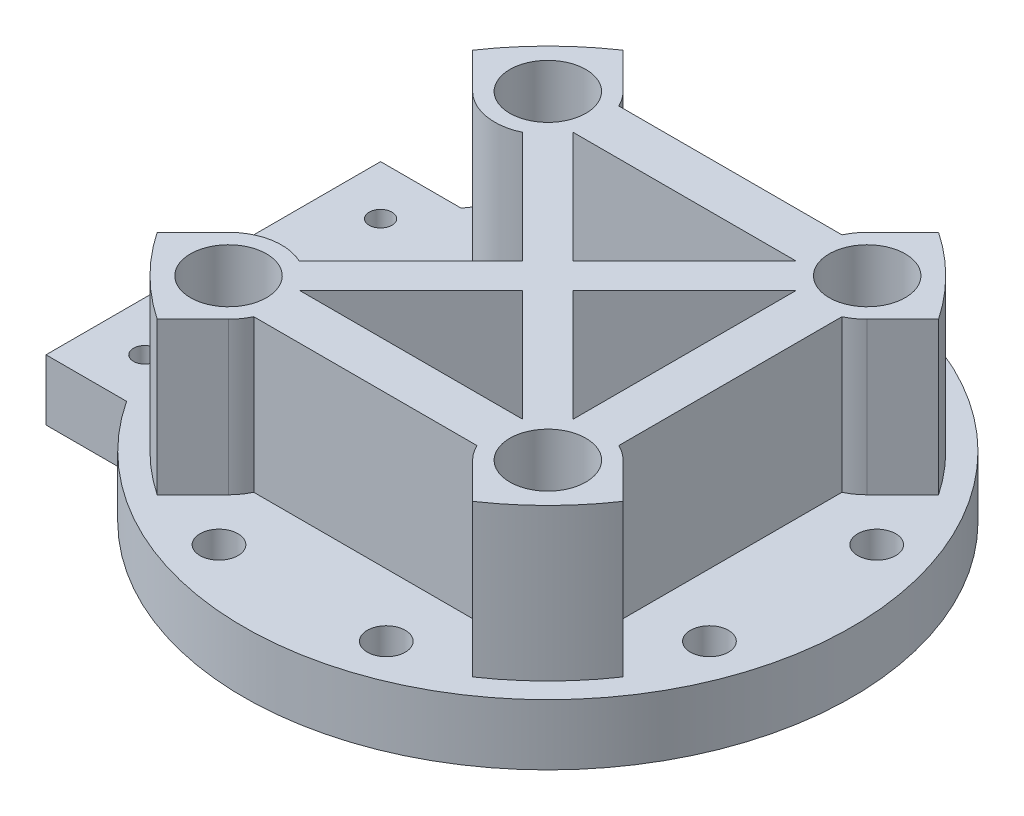
from build123d import *

# Parameters (mm, degrees)
SKETCH1_R           = 40
SKETCH1_R_2         = 9.5
SKETCH1_R_3         = 2.5
BOSS_EXTRUDE2_DEPTH = 8
SKETCH3_R           = 1.5
CUT_EXTRUDE1_DEPTH  = 8
SKETCH4_R           = 7
SKETCH4_R_2         = 5
BOSS_EXTRUDE6_DEPTH = 20


with BuildPart() as part:
    # Sketch1 → Boss-Extrude2 (new body)
    # profile 1 of 2: a face of its own
    with BuildSketch(Plane(origin=(0, 0, 0), x_dir=(1, 0, 0), z_dir=(0, 1, 0))):
        with BuildLine():
            Line((-44, 22), (-44, -22))
            Line((-44, -22), (-33.406586177, -22))
            ThreePointArc((-33.406586177, -22), (-40, 0), (-33.406586177, 22))
            Line((-33.406586177, 22), (-44, 22))
        make_face()
    # profile 2 of 2: a face of its own
    with BuildSketch(Plane(origin=(0, 0, 0), x_dir=(1, 0, 0), z_dir=(0, 1, 0))):
        Circle(SKETCH1_R)
        with Locations(Location((-22, 0, 0), (0, 0, 270))):
            Circle(SKETCH1_R_2, mode=Mode.SUBTRACT)
        with Locations(Location((11, 32.25, 0), (0, 0, 270))):
            Circle(SKETCH1_R_3, mode=Mode.SUBTRACT)
        with Locations(Location((-11, 32.25, 0), (0, 0, 270))):
            Circle(SKETCH1_R_3, mode=Mode.SUBTRACT)
        with Locations(Location((11, -32.25, 0), (0, 0, 270))):
            Circle(SKETCH1_R_3, mode=Mode.SUBTRACT)
        with Locations(Location((-11, -32.25, 0), (0, 0, 270))):
            Circle(SKETCH1_R_3, mode=Mode.SUBTRACT)
        with Locations(Location((32.25, -11, 0), (0, 0, 270))):
            Circle(SKETCH1_R_3, mode=Mode.SUBTRACT)
        with Locations(Location((32.25, 11, 0), (0, 0, 270))):
            Circle(SKETCH1_R_3, mode=Mode.SUBTRACT)
    extrude(amount=BOSS_EXTRUDE2_DEPTH)

    # Sketch3 → Cut-Extrude1 (cut)
    with BuildSketch(Plane(origin=(0, 8, 0), x_dir=(1, 0, 0), z_dir=(0, 1, 0))):
        with Locations(Location((-37.5, 15.5, 0), (0, 0, 270))):
            Circle(SKETCH3_R)
        with Locations(Location((-6.5, 15.5, 0), (0, 0, 270))):
            Circle(SKETCH3_R)
        with Locations(Location((-6.5, -15.5, 0), (0, 0, 270))):
            Circle(SKETCH3_R)
        with Locations(Location((-37.5, -15.5, 0), (0, 0, 270))):
            Circle(SKETCH3_R)
    extrude(amount=-CUT_EXTRUDE1_DEPTH, mode=Mode.SUBTRACT)

    # Sketch4 → Boss-Extrude6 (add)
    # profile 1 of 16: a face of its own
    with BuildSketch(Plane(origin=(0, 8, 0), x_dir=(1, 0, 0), z_dir=(0, 1, 0))):
        with Locations((-21, -21)):
            Circle(SKETCH4_R)
        with Locations(Location((-21, -21, 0), (0, 0, 270))):
            Circle(SKETCH4_R_2, mode=Mode.SUBTRACT)
    # profile 2 of 16: a face of its own
    with BuildSketch(Plane(origin=(0, 8, 0), x_dir=(1, 0, 0), z_dir=(0, 1, 0))):
        with BuildLine():
            ThreePointArc((-16.050252532, -25.949747468), (-25.949747468, -25.949747468), (-25.949747468, -16.050252532))
            Line((-25.949747468, -16.050252532), (-30.640212626, -20.740717689))
            ThreePointArc((-30.640212626, -20.740717689), (-26.162950904, -26.162950904), (-20.740717689, -30.640212626))
            Line((-20.740717689, -30.640212626), (-16.050252532, -25.949747468))
        make_face()
    # profile 3 of 16: a face of its own
    with BuildSketch(Plane(origin=(0, 8, 0), x_dir=(1, 0, 0), z_dir=(0, 1, 0))):
        with BuildLine():
            Line((-14.67544468, -18), (0, -3.32455532))
            Line((0, -3.32455532), (-3.32455532, 0))
            Line((-3.32455532, 0), (-18, -14.67544468))
            ThreePointArc((-18, -14.67544468), (-16.050252532, -16.050252532), (-14.67544468, -18))
        make_face()
    # profile 4 of 16: a face of its own
    with BuildSketch(Plane(origin=(0, 8, 0), x_dir=(1, 0, 0), z_dir=(0, 1, 0))):
        with BuildLine():
            ThreePointArc((14.67544468, -24), (14, -21), (14.67544468, -18))
            Line((14.67544468, -18), (14, -18))
            Line((14, -18), (-14.67544468, -18))
            ThreePointArc((-14.67544468, -18), (-14.170948556, -19.462451178), (-14, -21))
            ThreePointArc((-14, -21), (-14.170948556, -22.537548822), (-14.67544468, -24))
            Line((-14.67544468, -24), (14, -24))
            Line((14, -24), (14.67544468, -24))
        make_face()
    # profile 5 of 16: a face of its own
    with BuildSketch(Plane(origin=(0, 8, 0), x_dir=(1, 0, 0), z_dir=(0, 1, 0))):
        with Locations((21, -21)):
            Circle(SKETCH4_R)
        with Locations(Location((21, -21, 0), (0, 0, 270))):
            Circle(SKETCH4_R_2, mode=Mode.SUBTRACT)
    # profile 6 of 16: a face of its own
    with BuildSketch(Plane(origin=(0, 8, 0), x_dir=(1, 0, 0), z_dir=(0, 1, 0))):
        with BuildLine():
            Line((30.640212626, -20.740717689), (25.949747468, -16.050252532))
            ThreePointArc((25.949747468, -16.050252532), (27.467156728, -18.321215973), (28, -21))
            ThreePointArc((28, -21), (23.678784027, -27.467156728), (16.050252532, -25.949747468))
            Line((16.050252532, -25.949747468), (20.740717689, -30.640212626))
            ThreePointArc((20.740717689, -30.640212626), (26.162950904, -26.162950904), (30.640212626, -20.740717689))
        make_face()
    # profile 7 of 16: a face of its own
    with BuildSketch(Plane(origin=(0, 8, 0), x_dir=(1, 0, 0), z_dir=(0, 1, 0))):
        with BuildLine():
            ThreePointArc((14.67544468, -18), (16.050252532, -16.050252532), (18, -14.67544468))
            Line((18, -14.67544468), (3.32455532, 0))
            Line((3.32455532, 0), (0, -3.32455532))
            Line((0, -3.32455532), (14.67544468, -18))
        make_face()
    # profile 8 of 16: a face of its own
    with BuildSketch(Plane(origin=(0, 8, 0), x_dir=(1, 0, 0), z_dir=(0, 1, 0))):
        with BuildLine():
            Line((24, -14.446329174), (24, 14))
            Line((24, 14), (24, 14.67544468))
            ThreePointArc((24, 14.67544468), (21, 14), (18, 14.67544468))
            Line((18, 14.67544468), (18, 14))
            Line((18, 14), (18, -14.111462488))
            Line((18, -14.111462488), (18, -14.67544468))
            ThreePointArc((18, -14.67544468), (21, -14), (24, -14.67544468))
            Line((24, -14.67544468), (24, -14.446329174))
        make_face()
    # profile 9 of 16: a face of its own
    with BuildSketch(Plane(origin=(0, 8, 0), x_dir=(1, 0, 0), z_dir=(0, 1, 0))):
        with BuildLine():
            Line((3.32455532, 0), (18, 14.67544468))
            ThreePointArc((18, 14.67544468), (16.050252532, 16.050252532), (14.67544468, 18))
            Line((14.67544468, 18), (0, 3.32455532))
            Line((0, 3.32455532), (3.32455532, 0))
        make_face()
    # profile 10 of 16: a face of its own
    with BuildSketch(Plane(origin=(0, 8, 0), x_dir=(1, 0, 0), z_dir=(0, 1, 0))):
        Polygon((0, -3.32455532), (3.32455532, 0), (0, 3.32455532), (-3.32455532, 0), align=None)
    # profile 11 of 16: a face of its own
    with BuildSketch(Plane(origin=(0, 8, 0), x_dir=(1, 0, 0), z_dir=(0, 1, 0))):
        with BuildLine():
            Line((-3.32455532, 0), (0, 3.32455532))
            Line((0, 3.32455532), (-14.67544468, 18))
            ThreePointArc((-14.67544468, 18), (-16.050252532, 16.050252532), (-18, 14.67544468))
            Line((-18, 14.67544468), (-3.32455532, 0))
        make_face()
    # profile 12 of 16: a face of its own
    with BuildSketch(Plane(origin=(0, 8, 0), x_dir=(1, 0, 0), z_dir=(0, 1, 0))):
        with BuildLine():
            Line((13.75, 18), (14.67544468, 18))
            ThreePointArc((14.67544468, 18), (14, 21), (14.67544468, 24))
            Line((14.67544468, 24), (-13, 24))
            Line((-13, 24), (-13.890574763, 24))
            Line((-13.890574763, 24), (-14.67544468, 24))
            ThreePointArc((-14.67544468, 24), (-14.170948556, 22.537548822), (-14, 21))
            ThreePointArc((-14, 21), (-14.170948556, 19.462451178), (-14.67544468, 18))
            Line((-14.67544468, 18), (-14.243300619, 18))
            Line((-14.243300619, 18), (13.75, 18))
        make_face()
    # profile 13 of 16: a face of its own
    with BuildSketch(Plane(origin=(0, 8, 0), x_dir=(1, 0, 0), z_dir=(0, 1, 0))):
        with Locations((21, 21)):
            Circle(SKETCH4_R)
        with Locations(Location((21, 21, 0), (0, 0, 270))):
            Circle(SKETCH4_R_2, mode=Mode.SUBTRACT)
    # profile 14 of 16: a face of its own
    with BuildSketch(Plane(origin=(0, 8, 0), x_dir=(1, 0, 0), z_dir=(0, 1, 0))):
        with BuildLine():
            ThreePointArc((28, 21), (27.467156728, 18.321215973), (25.949747468, 16.050252532))
            Line((25.949747468, 16.050252532), (30.640212626, 20.740717689))
            ThreePointArc((30.640212626, 20.740717689), (26.162950904, 26.162950904), (20.740717689, 30.640212626))
            Line((20.740717689, 30.640212626), (16.050252532, 25.949747468))
            ThreePointArc((16.050252532, 25.949747468), (23.678784027, 27.467156728), (28, 21))
        make_face()
    # profile 15 of 16: a face of its own
    with BuildSketch(Plane(origin=(0, 8, 0), x_dir=(1, 0, 0), z_dir=(0, 1, 0))):
        with BuildLine():
            Line((-16.050252532, 25.949747468), (-20.740717689, 30.640212626))
            ThreePointArc((-20.740717689, 30.640212626), (-26.162950904, 26.162950904), (-30.640212626, 20.740717689))
            Line((-30.640212626, 20.740717689), (-25.949747469, 16.050252532))
            ThreePointArc((-25.949747469, 16.050252532), (-25.949747469, 25.949747468), (-16.050252532, 25.949747468))
        make_face()
    # profile 16 of 16: a face of its own
    with BuildSketch(Plane(origin=(0, 8, 0), x_dir=(1, 0, 0), z_dir=(0, 1, 0))):
        with Locations((-21, 21)):
            Circle(SKETCH4_R)
        with Locations(Location((-21, 21, 0), (0, 0, 270))):
            Circle(SKETCH4_R_2, mode=Mode.SUBTRACT)
    extrude(amount=BOSS_EXTRUDE6_DEPTH)


solid = part.part
